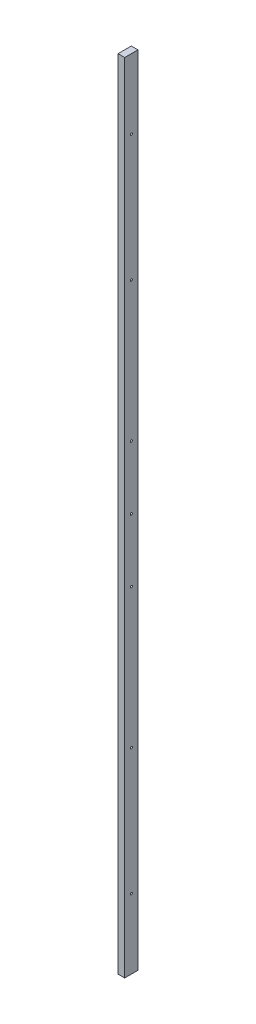
from build123d import *

# Parameters (mm, degrees)
SKETCH_1_W          = 25
SKETCH_1_H          = 50
EXTRUDE_1_DEPTH     = 3000
SKETCH_2_R          = 4
CUT_EXTRUDE_1_DEPTH = 3000
SKETCH_3_R          = 4
CUT_EXTRUDE_2_DEPTH = 3000
SKETCH_4_R          = 4
CUT_EXTRUDE_3_DEPTH = 3000
SKETCH_5_R          = 4
CUT_EXTRUDE_4_DEPTH = 50


with BuildPart() as part:
    # Эскиз1 → Бобышка-Вытянуть1 (new body)
    with BuildSketch(Plane(origin=(0, 0, 0), x_dir=(1, 0, 0), z_dir=(0, 1, 0))):
        Rectangle(SKETCH_1_W, SKETCH_1_H)
    extrude(amount=EXTRUDE_1_DEPTH)

    # Эскиз2 → Вырез-Вытянуть1 (cut)
    with BuildSketch(Plane(origin=(12.5, 0, 0), x_dir=(0, 0, -1), z_dir=(1, 0, 0))):
        with Locations((0, 2737.5)):
            Circle(SKETCH_2_R)
        with Locations((0, 262.5)):
            Circle(SKETCH_2_R)
        with Locations((0, 737.5)):
            Circle(SKETCH_2_R)
    extrude(amount=-CUT_EXTRUDE_1_DEPTH, mode=Mode.SUBTRACT)

    # Эскиз3 → Вырез-Вытянуть2 (cut)
    with BuildSketch(Plane.ZY.offset(12.5)):
        with Locations((0, 2262.5)):
            Circle(SKETCH_3_R)
    extrude(amount=-CUT_EXTRUDE_2_DEPTH, mode=Mode.SUBTRACT)

    # Эскиз4 → Вырез-Вытянуть3 (cut)
    with BuildSketch(Plane.ZY.offset(12.5)):
        with Locations((0, 1737.5)):
            Circle(SKETCH_4_R)
        with Locations((0, 1262.5)):
            Circle(SKETCH_4_R)
    extrude(amount=-CUT_EXTRUDE_3_DEPTH, mode=Mode.SUBTRACT)

    # Эскиз5 → Вырез-Вытянуть4 (cut)
    with BuildSketch(Plane.ZY.offset(12.5)):
        with Locations((0, 1500)):
            Circle(SKETCH_5_R)
    extrude(amount=-CUT_EXTRUDE_4_DEPTH, mode=Mode.SUBTRACT)


solid = part.part
